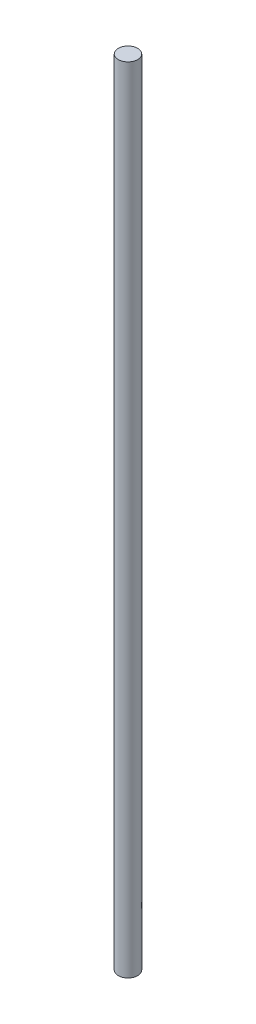
from build123d import *

# Parameters (mm, degrees)
SKETCH1_R           = 4
BOSS_EXTRUDE1_DEPTH = 326


with BuildPart() as part:
    # Sketch1 → Boss-Extrude1 (new body)
    with BuildSketch(Plane(origin=(0, 0, 0), x_dir=(1, 0, 0), z_dir=(0, 1, 0))):
        with Locations(Location((0, 0, 0), (0, 0, 270))):
            Circle(SKETCH1_R)
    extrude(amount=BOSS_EXTRUDE1_DEPTH)


solid = part.part
